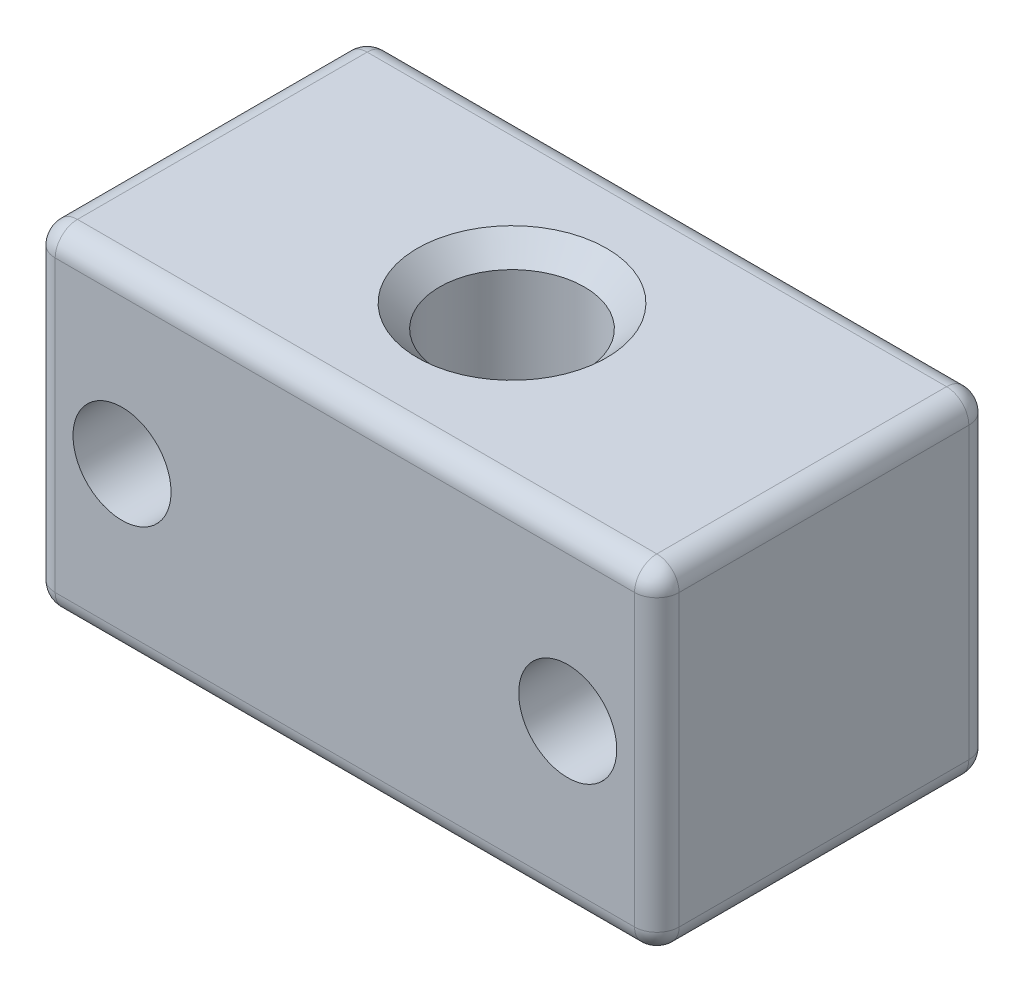
from build123d import *

# Parameters (mm, degrees)
SKETCH_1_W          = 28
SKETCH_1_H          = 15
SKETCH_1_R          = 3.25
EXTRUDE_1_DEPTH     = 7.5
SKETCH_2_R          = 2.2
CUT_EXTRUDE_1_DEPTH = 15
FILLET_1_R          = 1
CHAMFER_1_SIZE      = 1


with BuildPart() as part:
    # 草图1 → 凸台-拉伸1 (new, symmetric)
    with BuildSketch(Plane(origin=(0, 0, 0), x_dir=(1, 0, 0), z_dir=(0, 1, 0))):
        Rectangle(SKETCH_1_W, SKETCH_1_H)
        with Locations(Location((0, 0, 0), (0, 0, 270))):
            Circle(SKETCH_1_R, mode=Mode.SUBTRACT)
    extrude(amount=EXTRUDE_1_DEPTH, both=True)

    # 草图2 → 切除-拉伸1 (cut)
    with BuildSketch(Plane.XY.offset(7.5)):
        with Locations((-10, 0)):
            Circle(SKETCH_2_R)
        with Locations((10, 0)):
            Circle(SKETCH_2_R)
    extrude(amount=-CUT_EXTRUDE_1_DEPTH, mode=Mode.SUBTRACT)

    # 圆角1
    fillet_1_edges = [part.edges().sort_by_distance(p)[0] for p in [
        (-14, 7.5, 0),
        (0, 7.5, 7.5),
        (14, 7.5, 0),
        (0, -7.5, 7.5),
        (-14, -7.5, 0),
        (0, -7.5, -7.5),
        (14, -7.5, 0),
        (14, 0, 7.5),
        (-14, 0, 7.5),
        (-14, 0, -7.5),
        (14, 0, -7.5),
        (0, 7.5, -7.5),
    ]]
    fillet(fillet_1_edges, radius=FILLET_1_R)

    # 倒角1
    chamfer_1_edges = [part.edges().sort_by_distance(p)[0] for p in [
        (0, -7.5, -3.25),
        (0, 7.5, -3.25),
    ]]
    chamfer(chamfer_1_edges, length=CHAMFER_1_SIZE)


solid = part.part
